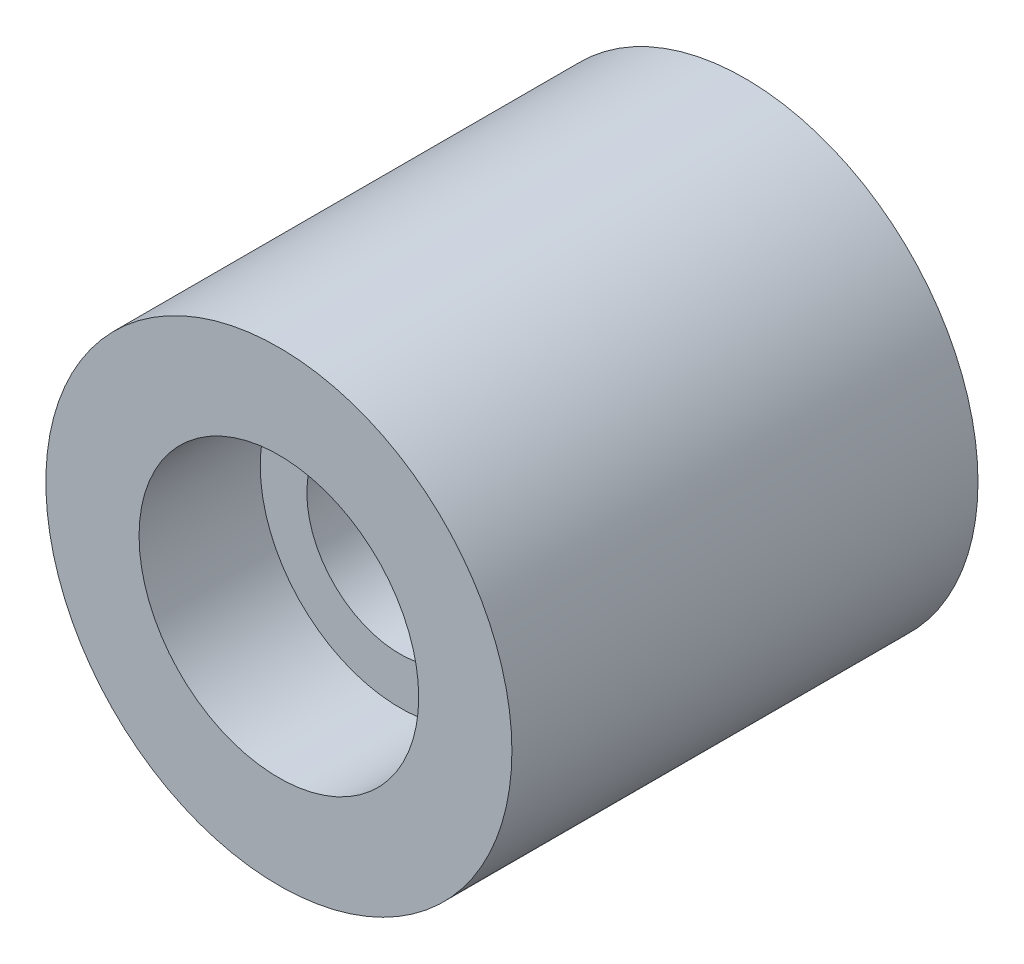
from build123d import *


with BuildPart() as part:
    # Croquis2 → Revolución1 (revolve)
    with BuildSketch(Plane(origin=(0, 0, 0), x_dir=(1, 0, 0), z_dir=(0, 1, 0)), mode=Mode.PRIVATE) as revoluci_n1_sk:
        Polygon((-1.5, 0), (-2.5, 0), (-2.5, 5), (-1, 5), (-1, 4.5), (-2, 4.5), (-2, 1.8), (-1, 1.8), (-1, 1.3), (-1.5, 1.3), align=None)
    revolve(revoluci_n1_sk.sketch.rotate(Axis((0, 0, 0), (0, 0, -1)), 180), axis=Axis((0, 0, 0), (0, 0, -1)))


solid = part.part
